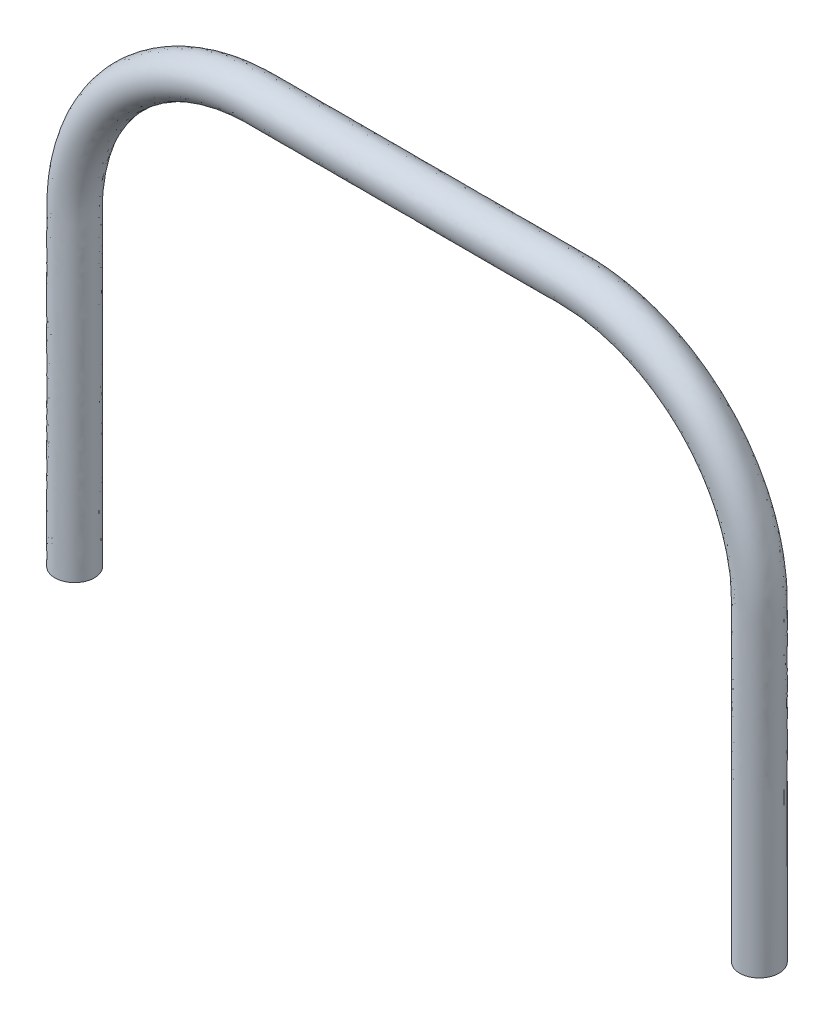
from build123d import *

# Parameters (mm, degrees)
BALAYAGE1_PROFILE_R = 15.875


with BuildPart() as part:
    # Balayage1: sweep along a path in Esquisse2
    with BuildLine(Plane.XY) as balayage1_path:
        Line((0, 0), (0, 250))
        ThreePointArc((0, 250), (43.933982822, 356.066017178), (150, 400))
        Line((150, 400), (400, 400))
        ThreePointArc((400, 400), (506.066017178, 356.066017178), (550, 250))
        Line((550, 250), (550, 0))
    # Balayage1 profile (on start of the path) → Balayage1 (sweep)
    with BuildSketch(Plane.ZX):
        Circle(BALAYAGE1_PROFILE_R)
    sweep(path=balayage1_path.line)


solid = part.part
